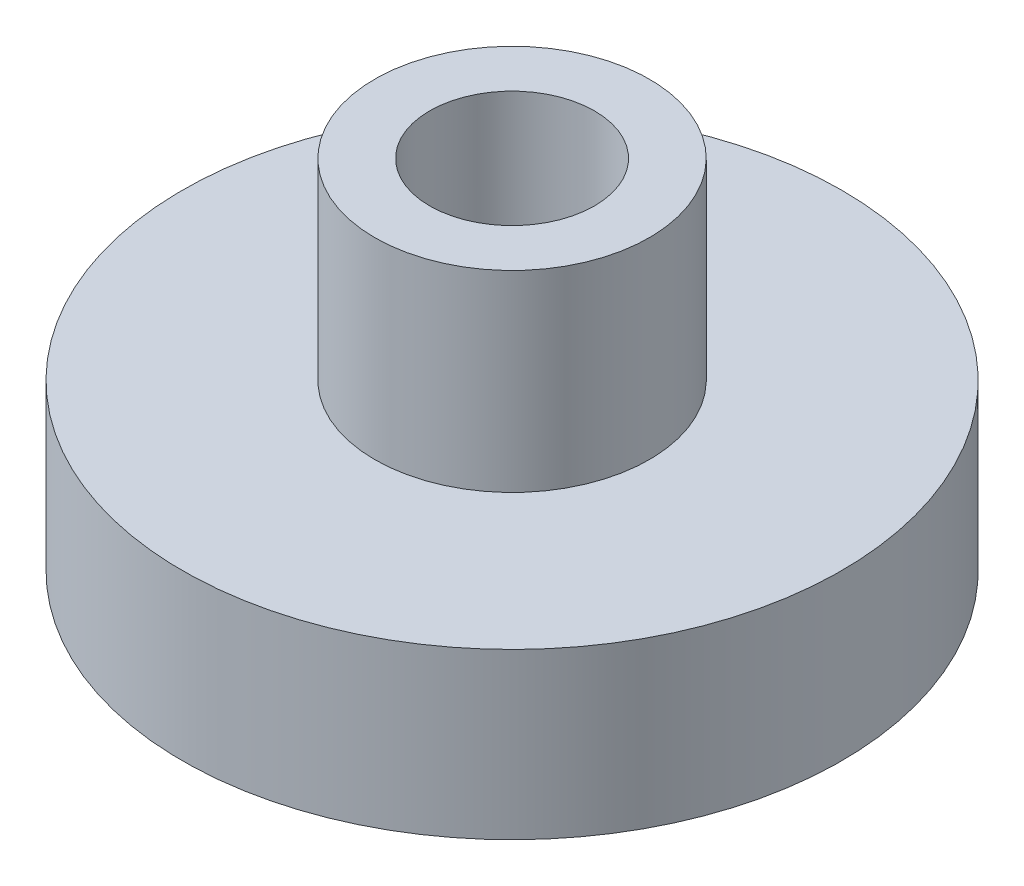
from build123d import *
from build123d.topology import SkipClean

# Parameters (mm, degrees)
SKETCH_1_R      = 2.5
SKETCH_1_R_2    = 1.5
EXTRUDE_1_DEPTH = 3.5
EXTRUDE_START   = 3
SKETCH_2_R      = 6
SKETCH_2_R_2    = 1.5
EXTRUDE_2_DEPTH = 3


with BuildPart() as part:
    # 草图1 → 凸台-拉伸1 (new body)
    with BuildSketch(Plane(origin=(0, 0, 0), x_dir=(1, 0, 0), z_dir=(0, 1, 0))):
        with Locations(Location((0, 0, 0), (0, 0, 270))):
            Circle(SKETCH_1_R)
        with Locations(Location((0, 0, 0), (0, 0, 270))):
            Circle(SKETCH_1_R_2, mode=Mode.SUBTRACT)
    extrude(amount=EXTRUDE_1_DEPTH)

    # 草图2 → 凸台-拉伸2 (add)
    with SkipClean():  # the faces are left unmerged after this step: merging them gives an invalid solid
        with BuildSketch(Plane.XZ.offset(EXTRUDE_START)):
            with Locations(Location((0, 0, 0), (0, 0, 270))):
                Circle(SKETCH_2_R)
            with Locations(Location((0, 0, 0), (0, 0, 270))):
                Circle(SKETCH_2_R_2, mode=Mode.SUBTRACT)
        extrude(amount=-EXTRUDE_2_DEPTH)


solid = part.part
